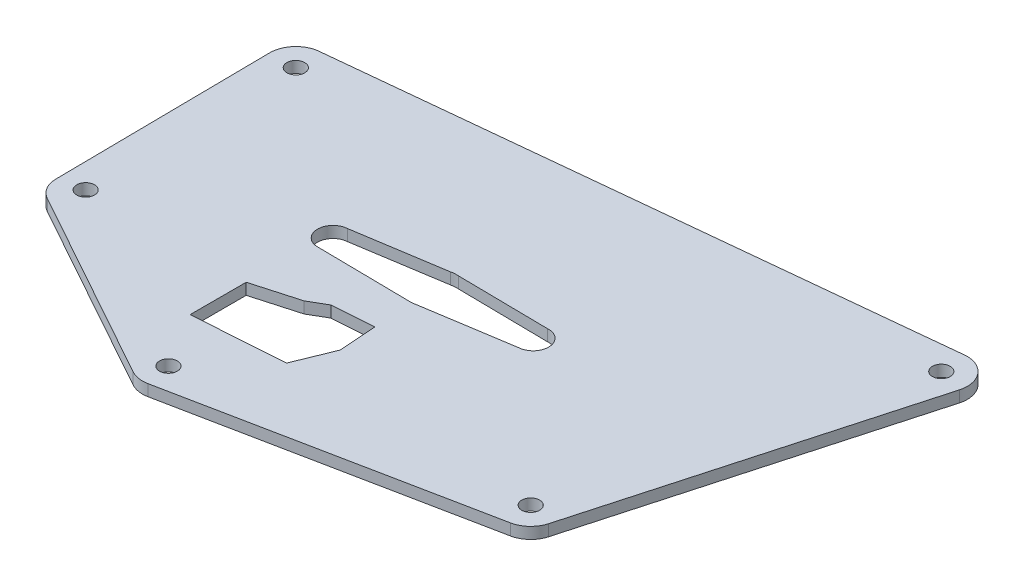
from build123d import *

# Parameters (mm, degrees)
SKETCH1_R            = 2.4892
BOSS_EXTRUDE1_DEPTH  = 3.175
TRIGGER_CUTOUT_DEPTH = 3.175
SERVO_CUTOUT_DEPTH   = 3.175


with BuildPart() as part:
    # Sketch1 → Boss-Extrude1 (new body)
    with BuildSketch(Plane(origin=(0, 0, 0), x_dir=(1, 0, 0), z_dir=(0, 1, 0))):
        with BuildLine():
            Line((-6.8229868, -7.488197853), (47.14701474, -37.472309865))
            ThreePointArc((47.14701474, -37.472309865), (49.553689318, -38.298669515), (52.097667916, -38.242761734))
            Line((52.097667916, -38.242761734), (136.359344262, -21.308190288))
            ThreePointArc((136.359344262, -21.308190288), (139.866879533, -19.510833837), (141.916296901, -16.144354617))
            Line((141.916296901, -16.144354617), (166.90343399, 73.568749369))
            ThreePointArc((166.90343399, 73.568749369), (165.462253091, 80.188248266), (159.182077212, 82.728751949))
            Line((159.182077212, 82.728751949), (-4.366145722, 66.053653766))
            ThreePointArc((-4.366145722, 66.053653766), (-9.125920254, 63.663982971), (-10.969503308, 58.667265887))
            Line((-10.969503308, 58.667265887), (-10.288924124, -1.672992978))
            ThreePointArc((-10.288924124, -1.672992978), (-9.33910622, -5.047363397), (-6.8229868, -7.488197853))
        make_face()
        with Locations(Location((159.917634832, 75.514453101, 0), (0, 0, 270))):
            Circle(SKETCH1_R, mode=Mode.SUBTRACT)
        with Locations(Location((134.930497743, -14.198650885, 0), (0, 0, 270))):
            Circle(SKETCH1_R, mode=Mode.SUBTRACT)
        with Locations(Location((50.668821397, -31.133222331, 0), (0, 0, 270))):
            Circle(SKETCH1_R, mode=Mode.SUBTRACT)
        with Locations(Location((-3.719648143, 58.830829265, 0), (0, 0, 270))):
            Circle(SKETCH1_R, mode=Mode.SUBTRACT)
        with Locations(Location((-3.508126319, -0.086017173, 0), (0, 0, 270))):
            Circle(SKETCH1_R, mode=Mode.SUBTRACT)
    extrude(amount=BOSS_EXTRUDE1_DEPTH)

    # Sketch3 → trigger cutout (cut)
    with BuildSketch(Plane(origin=(0, 3.175, 0), x_dir=(1, 0, 0), z_dir=(0, 1, 0))):
        Polygon((41.255934536, -15.678441329), (66.468104622, -13.883980824), (70.774809833, -3.296663849), (70.032795293, 7.128640439), (58.56546888, 6.312460623), (53.862019579, 3.583115238), (41.255934536, 0), align=None)
    extrude(amount=-TRIGGER_CUTOUT_DEPTH, mode=Mode.SUBTRACT)

    # Sketch4 → servo cutout (cut)
    with BuildSketch(Plane(origin=(0, 3.175, 0), x_dir=(1, 0, 0), z_dir=(0, 1, 0))):
        with BuildLine():
            Line((69.425949058, 31.19523761), (94.572562087, 30.850872889))
            ThreePointArc((94.572562087, 30.850872889), (99.186221889, 26.850324024), (95.185673024, 22.236664221))
            Line((95.185673024, 22.236664221), (70.3413237, 18.334223888))
            ThreePointArc((70.3413237, 18.334223888), (69.247473844, 18.162406798), (68.140315886, 18.177568527))
            Line((68.140315886, 18.177568527), (42.993702858, 18.521933248))
            ThreePointArc((42.993702858, 18.521933248), (38.380043055, 22.522482114), (42.380591921, 27.136141916))
            Line((42.380591921, 27.136141916), (67.224941244, 31.03858225))
            ThreePointArc((67.224941244, 31.03858225), (68.318791101, 31.210399339), (69.425949058, 31.19523761))
        make_face()
    extrude(amount=-SERVO_CUTOUT_DEPTH, mode=Mode.SUBTRACT)


solid = part.part
